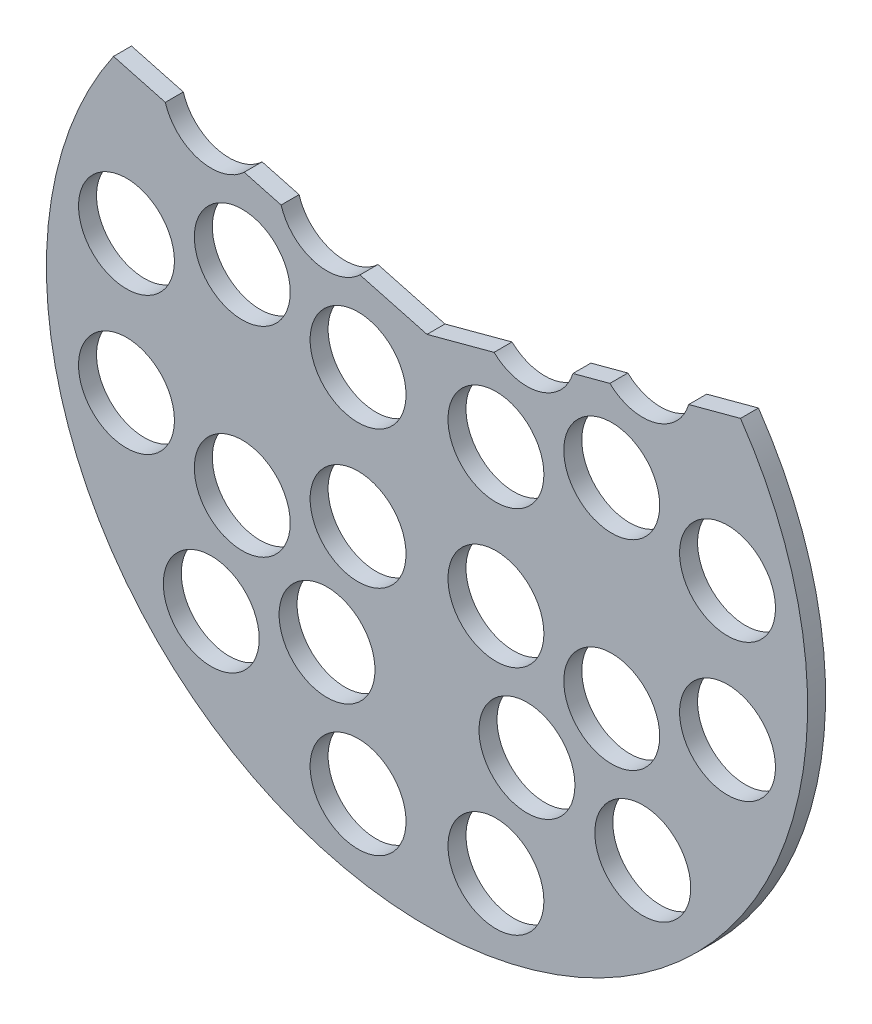
from build123d import *

# Parameters (mm, degrees)
SKETCH1_R           = 31.75
SKETCH1_R_2         = 4
BOSS_EXTRUDE1_DEPTH = 1.5
CUT_EXTRUDE1_DEPTH  = 45.926328584


with BuildPart() as part:
    # Sketch1 → Boss-Extrude1 (new body)
    with BuildSketch(Plane.XY):
        Circle(SKETCH1_R)
        with Locations((5.75, 5.75)):
            Circle(SKETCH1_R_2, mode=Mode.SUBTRACT)
        with Locations((8.338190451, 15.409258263)):
            Circle(SKETCH1_R_2, mode=Mode.SUBTRACT)
        with Locations((17.997448714, 17.997448714)):
            Circle(SKETCH1_R_2, mode=Mode.SUBTRACT)
        with Locations((15.409258263, 8.338190451)):
            Circle(SKETCH1_R_2, mode=Mode.SUBTRACT)
        with Locations((25.068516526, 5.75)):
            Circle(SKETCH1_R_2, mode=Mode.SUBTRACT)
        with Locations((5.75, 25.068516526)):
            Circle(SKETCH1_R_2, mode=Mode.SUBTRACT)
        with Locations((25.068556101, -5.749960425)):
            Circle(SKETCH1_R_2, mode=Mode.SUBTRACT)
        with Locations((15.409297838, -8.338150876)):
            Circle(SKETCH1_R_2, mode=Mode.SUBTRACT)
        with Locations((17.997488289, -17.997409139)):
            Circle(SKETCH1_R_2, mode=Mode.SUBTRACT)
        with Locations((8.338230026, -15.409218688)):
            Circle(SKETCH1_R_2, mode=Mode.SUBTRACT)
        with Locations((5.750039575, -25.068476951)):
            Circle(SKETCH1_R_2, mode=Mode.SUBTRACT)
        with Locations((5.750039575, -5.749960425)):
            Circle(SKETCH1_R_2, mode=Mode.SUBTRACT)
        with Locations((-5.74992085, -25.068516526)):
            Circle(SKETCH1_R_2, mode=Mode.SUBTRACT)
        with Locations((-8.338111301, -15.409258263)):
            Circle(SKETCH1_R_2, mode=Mode.SUBTRACT)
        with Locations((-17.997369564, -17.997448714)):
            Circle(SKETCH1_R_2, mode=Mode.SUBTRACT)
        with Locations((-15.409179113, -8.338190451)):
            Circle(SKETCH1_R_2, mode=Mode.SUBTRACT)
        with Locations((-25.068437376, -5.75)):
            Circle(SKETCH1_R_2, mode=Mode.SUBTRACT)
        with Locations((-5.74992085, -5.75)):
            Circle(SKETCH1_R_2, mode=Mode.SUBTRACT)
        with Locations((-25.068476951, 5.749960425)):
            Circle(SKETCH1_R_2, mode=Mode.SUBTRACT)
        with Locations((-15.409218688, 8.338150876)):
            Circle(SKETCH1_R_2, mode=Mode.SUBTRACT)
        with Locations((-17.997409139, 17.997409139)):
            Circle(SKETCH1_R_2, mode=Mode.SUBTRACT)
        with Locations((-8.338150876, 15.409218688)):
            Circle(SKETCH1_R_2, mode=Mode.SUBTRACT)
        with Locations((-5.749960425, 25.068476951)):
            Circle(SKETCH1_R_2, mode=Mode.SUBTRACT)
        with Locations((-5.749960425, 5.749960425)):
            Circle(SKETCH1_R_2, mode=Mode.SUBTRACT)
    extrude(amount=BOSS_EXTRUDE1_DEPTH)

    # Sketch2 → Cut-Extrude1 (cut, through all)
    with BuildSketch(Plane.XY):
        with BuildLine():
            Line((-26.149880274, 18.006839302), (0, 11))
            Line((0, 11), (26.149880274, 18.006839302))
            ThreePointArc((26.149880274, 18.006839302), (0, 31.75), (-26.149880274, 18.006839302))
        make_face()
    extrude(amount=CUT_EXTRUDE1_DEPTH, mode=Mode.SUBTRACT)


solid = part.part
